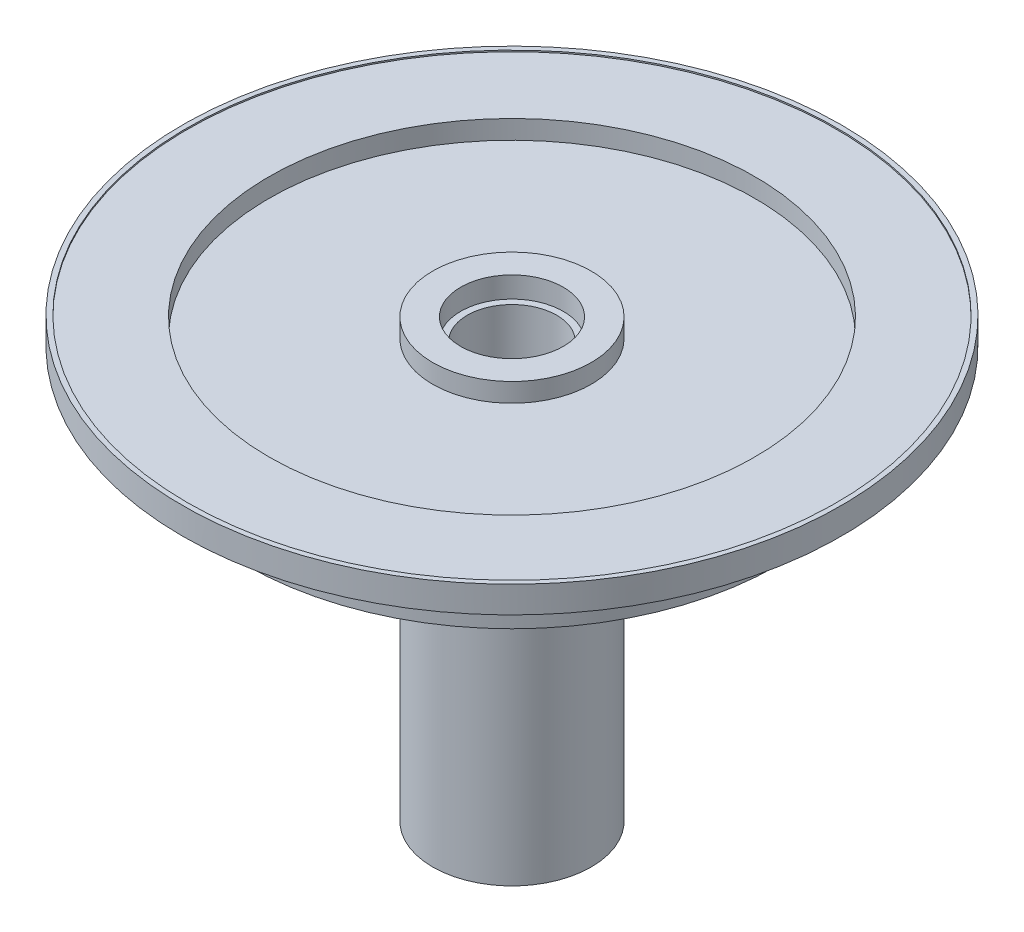
from build123d import *

# Parameters (mm, degrees)
SKETCH1_R           = 38.1
BOSS_EXTRUDE1_DEPTH = 4.826
SKETCH2_R           = 38.1
BOSS_EXTRUDE2_DEPTH = 3.302
BOSS_EXTRUDE2_DRAFT = -70
SKETCH3_R           = 47.172170439
BOSS_EXTRUDE3_DEPTH = 3.81
SKETCH4_R           = 46.472170439
CUT_EXTRUDE1_DEPTH  = 0.2
SKETCH6_R           = 34.772170439
SKETCH6_R_2         = 11.35
CUT_EXTRUDE2_DEPTH  = 2.7
SKETCH7_R           = 5.35
CUT_EXTRUDE3_DEPTH  = 68.736312063
SKETCH8_R           = 11.35
SKETCH8_R_2         = 5.35
BOSS_EXTRUDE4_DEPTH = 50.8
SKETCH9_R           = 7.35
CUT_EXTRUDE4_DEPTH  = 3
CUT_EXTRUDE5_START  = -3
SKETCH10_R          = 7.35
CUT_EXTRUDE5_DEPTH  = 3
SKETCH12_R          = 6.4
CUT_EXTRUDE8_DEPTH  = 83.032578722
SKETCH13_R          = 6.4
CUT_EXTRUDE9_DEPTH  = 80.227293099


with BuildPart() as part:
    # Sketch1 → Boss-Extrude1 (new body)
    with BuildSketch(Plane(origin=(0, 0, 0), x_dir=(1, 0, 0), z_dir=(0, 1, 0))):
        with Locations(Location((0, 0, 0), (0, 0, 270))):
            Circle(SKETCH1_R)
    extrude(amount=BOSS_EXTRUDE1_DEPTH)


with BuildPart() as boss_extrude2_tool:
    # Sketch2 → Boss-Extrude2 (with draft: the straight prism first)
    with BuildSketch(Plane(origin=(0, 4.826, 0), x_dir=(1, 0, 0), z_dir=(0, 1, 0))):
        with Locations(Location((0, 0, 0), (0, 0, 270))):
            Circle(SKETCH2_R)
    extrude(amount=BOSS_EXTRUDE2_DEPTH)
    # Boss-Extrude2: the draft: its side faces are tilted about the plane it starts from
    boss_extrude2_sides = [boss_extrude2_tool.faces().sort_by_distance(p)[0] for p in [
        (0, 6.477, -38.1),
    ]]
    draft(boss_extrude2_sides, Plane(origin=(0, 4.826, 0), x_dir=(1, 0, 0), z_dir=(0, 1, 0)), BOSS_EXTRUDE2_DRAFT)


with BuildPart() as part_1:
    add(part.part)

    # Boss-Extrude2: add boss_extrude2_tool
    add(boss_extrude2_tool.part)

    # Sketch3 → Boss-Extrude3 (add)
    with BuildSketch(Plane(origin=(0, 8.128, 0), x_dir=(1, 0, 0), z_dir=(0, 1, 0))):
        with Locations(Location((0, 0, 0), (0, 0, 90))):
            Circle(SKETCH3_R)
    extrude(amount=BOSS_EXTRUDE3_DEPTH)

    # Sketch4 → Cut-Extrude1 (cut)
    with BuildSketch(Plane(origin=(0, 11.938, 0), x_dir=(1, 0, 0), z_dir=(0, 1, 0))):
        with Locations(Location((0, 0, 0), (0, 0, 270))):
            Circle(SKETCH4_R)
    extrude(amount=-CUT_EXTRUDE1_DEPTH, mode=Mode.SUBTRACT)

    # Sketch6 → Cut-Extrude2 (cut)
    with BuildSketch(Plane(origin=(0, 11.738, 0), x_dir=(1, 0, 0), z_dir=(0, 1, 0))):
        with Locations(Location((0, 0, 0), (0, 0, 270))):
            Circle(SKETCH6_R)
        with Locations(Location((0, 0, 0), (0, 0, 270))):
            Circle(SKETCH6_R_2, mode=Mode.SUBTRACT)
    extrude(amount=-CUT_EXTRUDE2_DEPTH, mode=Mode.SUBTRACT)

    # Sketch7 → Cut-Extrude3 (cut, through all)
    with BuildSketch(Plane(origin=(0, 11.738, 0), x_dir=(1, 0, 0), z_dir=(0, 1, 0))):
        with Locations(Location((0, 0, 0), (0, 0, 270))):
            Circle(SKETCH7_R)
    extrude(amount=-CUT_EXTRUDE3_DEPTH, mode=Mode.SUBTRACT)

    # Sketch8 → Boss-Extrude4 (add)
    with BuildSketch(Plane.XZ):
        with Locations(Location((0, 0, 0), (0, 0, 90))):
            Circle(SKETCH8_R)
        with Locations(Location((0, 0, 0), (0, 0, 90))):
            Circle(SKETCH8_R_2, mode=Mode.SUBTRACT)
    extrude(amount=BOSS_EXTRUDE4_DEPTH)

    # Sketch9 → Cut-Extrude4 (cut)
    with BuildSketch(Plane.XZ.offset(50.8)):
        with Locations(Location((0, 0, 0), (0, 0, 270))):
            Circle(SKETCH9_R)
    extrude(amount=-CUT_EXTRUDE4_DEPTH, mode=Mode.SUBTRACT)

    # Sketch10 → Cut-Extrude5 (cut)
    with BuildSketch(Plane(origin=(0, 11.738, 0), x_dir=(1, 0, 0), z_dir=(0, 1, 0)).offset(CUT_EXTRUDE5_START)):
        with Locations(Location((0, 0, 0), (0, 0, 90))):
            Circle(SKETCH10_R)
    extrude(amount=CUT_EXTRUDE5_DEPTH, mode=Mode.SUBTRACT)

    # Sketch12 → Cut-Extrude8 (cut, through all)
    with BuildSketch(Plane(origin=(0, -35.8, 0), x_dir=(-1, 0, 0), z_dir=(0, -1, 0))):
        with Locations(Location((0, 0, 0), (0, 0, 90))):
            Circle(SKETCH12_R)
    extrude(amount=CUT_EXTRUDE8_DEPTH, mode=Mode.SUBTRACT)

    # Sketch13 → Cut-Extrude9 (cut, through all)
    with BuildSketch(Plane(origin=(0, -30.8, 0), x_dir=(-1, 0, 0), z_dir=(0, -1, 0))):
        with Locations(Location((0, 0, 0), (0, 0, 90))):
            Circle(SKETCH13_R)
    extrude(amount=-CUT_EXTRUDE9_DEPTH, mode=Mode.SUBTRACT)


solid = part_1.part
